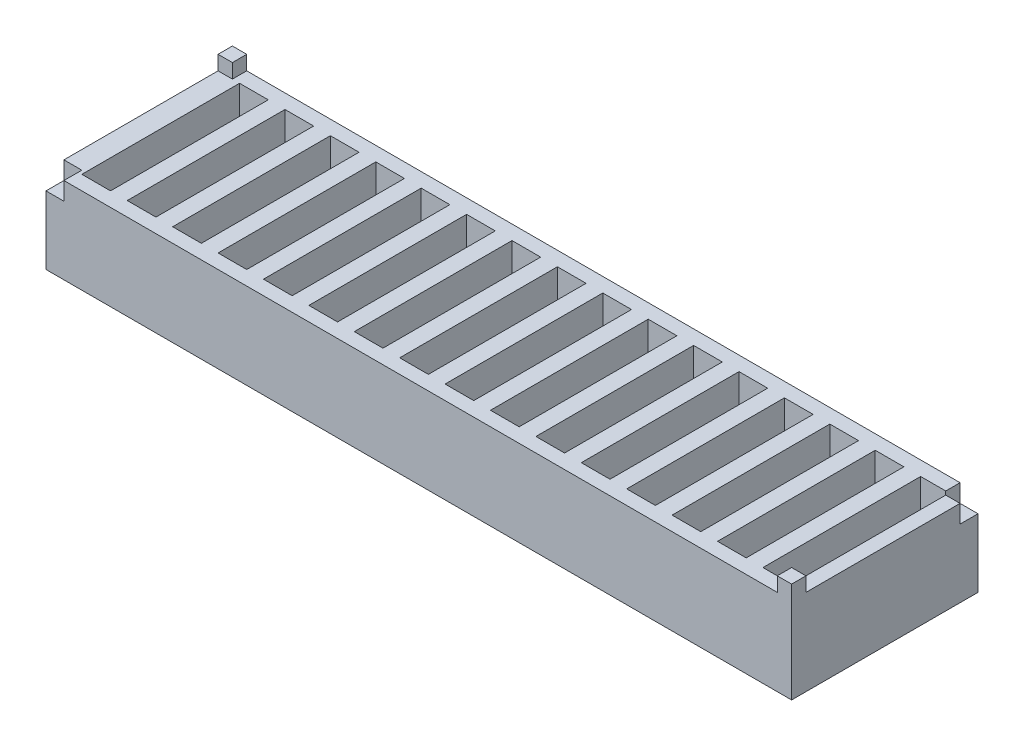
from build123d import *

# Parameters (mm, degrees)
SKETCH1_W           = 104
SKETCH1_H           = 26
BOSS_EXTRUDE1_DEPTH = 12
SKETCH2_W           = 4
SKETCH2_H           = 22
CUT_EXTRUDE1_DEPTH  = 11
SKETCH3_W           = 2
SKETCH3_H           = 2
BOSS_EXTRUDE2_DEPTH = 2
SKETCH4_W           = 2.5
SKETCH4_H           = 2.5
CUT_EXTRUDE2_DEPTH  = 2.5


with BuildPart() as part:
    # Sketch1 → Boss-Extrude1 (new body)
    with BuildSketch(Plane(origin=(0, 0, 0), x_dir=(1, 0, 0), z_dir=(0, 1, 0))):
        Rectangle(SKETCH1_W, SKETCH1_H)
    extrude(amount=BOSS_EXTRUDE1_DEPTH)

    # Sketch2 → Cut-Extrude1 (cut)
    with BuildSketch(Plane(origin=(0, 12, 0), x_dir=(1, 0, 0), z_dir=(0, 1, 0))):
        with Locations((-47, 0)):
            Rectangle(SKETCH2_W, SKETCH2_H)
        with Locations((-40.666666667, 0)):
            Rectangle(SKETCH2_W, SKETCH2_H)
        with Locations((-34.333333333, 0)):
            Rectangle(SKETCH2_W, SKETCH2_H)
        with Locations((-28, 0)):
            Rectangle(SKETCH2_W, SKETCH2_H)
        with Locations((-21.666666667, 0)):
            Rectangle(SKETCH2_W, SKETCH2_H)
        with Locations((-15.333333333, 0)):
            Rectangle(SKETCH2_W, SKETCH2_H)
        with Locations((-9, 0)):
            Rectangle(SKETCH2_W, SKETCH2_H)
        with Locations((-2.666666667, 0)):
            Rectangle(SKETCH2_W, SKETCH2_H)
        with Locations((3.666666667, 0)):
            Rectangle(SKETCH2_W, SKETCH2_H)
        with Locations((10, 0)):
            Rectangle(SKETCH2_W, SKETCH2_H)
        with Locations((16.333333333, 0)):
            Rectangle(SKETCH2_W, SKETCH2_H)
        with Locations((22.666666667, 0)):
            Rectangle(SKETCH2_W, SKETCH2_H)
        with Locations((29, 0)):
            Rectangle(SKETCH2_W, SKETCH2_H)
        with Locations((35.333333333, 0)):
            Rectangle(SKETCH2_W, SKETCH2_H)
        with Locations((41.666666667, 0)):
            Rectangle(SKETCH2_W, SKETCH2_H)
        with Locations((48, 0)):
            Rectangle(SKETCH2_W, SKETCH2_H)
    extrude(amount=-CUT_EXTRUDE1_DEPTH, mode=Mode.SUBTRACT)

    # Sketch3 → Boss-Extrude2 (add)
    with BuildSketch(Plane(origin=(0, 12, 0), x_dir=(1, 0, 0), z_dir=(0, 1, 0))):
        with Locations((-51, 12)):
            Rectangle(SKETCH3_W, SKETCH3_H)
        with Locations((51, -12)):
            Rectangle(SKETCH3_W, SKETCH3_H)
    extrude(amount=BOSS_EXTRUDE2_DEPTH)

    # Sketch4 → Cut-Extrude2 (cut)
    with BuildSketch(Plane(origin=(0, 12, 0), x_dir=(1, 0, 0), z_dir=(0, 1, 0))):
        with Locations((-50.75, -11.75)):
            Rectangle(SKETCH4_W, SKETCH4_H)
        with Locations((50.75, 11.75)):
            Rectangle(SKETCH4_W, SKETCH4_H)
    extrude(amount=-CUT_EXTRUDE2_DEPTH, mode=Mode.SUBTRACT)


solid = part.part
